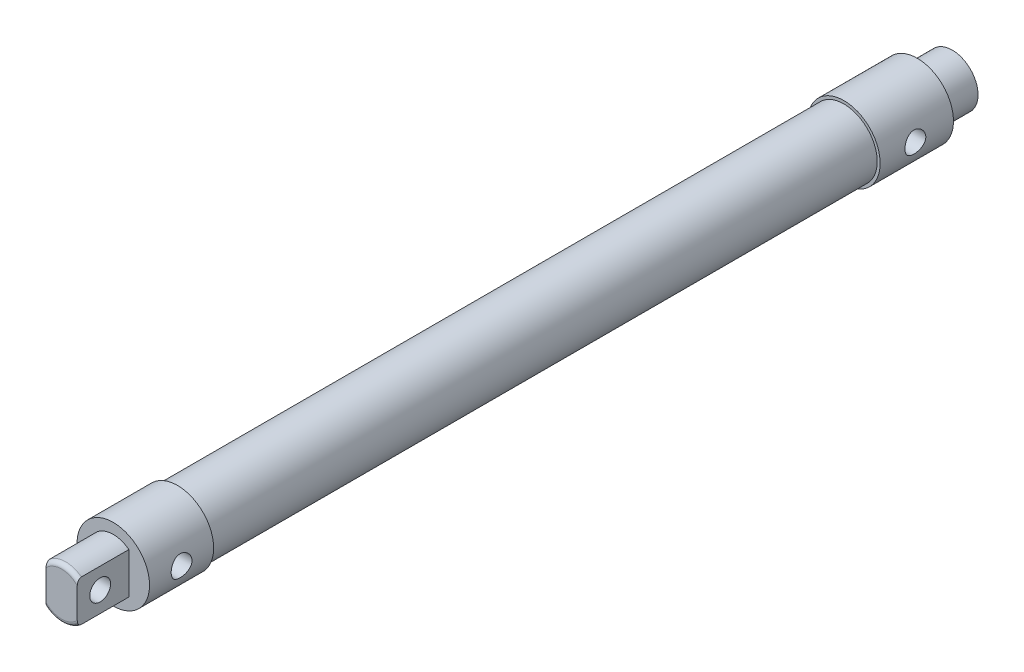
from build123d import *

# Parameters (mm, degrees)
SKETCH1_R               = 10.16
BOSS_EXTRUDE1_DEPTH     = 203.2
SKETCH2_R               = 11.049
BOSS_EXTRUDE2_DEPTH     = 19.558
BOSS_EXTRUDE3_DEPTH     = 15.748
SKETCH4_R               = 3.175
CUT_EXTRUDE1_DEPTH      = 9.525
FILLET1_R               = 1.27
SKETCH5_R               = 11.049
BOSS_EXTRUDE4_DEPTH     = 22.352
SKETCH6_R               = 7.874
BOSS_EXTRUDE5_DEPTH     = 10.668
SKETCH7_R               = 3.175
CUT_EXTRUDE2_DEPTH      = 124.968
CUT_EXTRUDE3_REACH      = 241.017
CUT_EXTRUDE3_END_RADIUS = 11.049
SKETCH8_R               = 3.175


with BuildPart() as part:
    # Sketch1 → Boss-Extrude1 (new body)
    with BuildSketch(Plane.XY):
        Circle(SKETCH1_R)
    extrude(amount=BOSS_EXTRUDE1_DEPTH)

    # Sketch5 → Boss-Extrude4 (add)
    with BuildSketch(Plane(origin=(0, 0, 0), x_dir=(-1, 0, 0), z_dir=(0, 0, -1))):
        with Locations(Location((0, 0, 0), (0, 0, 180))):
            Circle(SKETCH5_R)
    extrude(amount=BOSS_EXTRUDE4_DEPTH)

    # Sketch6 → Boss-Extrude5 (add)
    with BuildSketch(Plane(origin=(0, 0, -22.352), x_dir=(-1, 0, 0), z_dir=(0, 0, -1))):
        Circle(SKETCH6_R)
    extrude(amount=BOSS_EXTRUDE5_DEPTH)

    # Sketch7 → Cut-Extrude2 (cut)
    with BuildSketch(Plane(origin=(0, 0, -33.02), x_dir=(-1, 0, 0), z_dir=(0, 0, -1))):
        Circle(SKETCH7_R)
    extrude(amount=-CUT_EXTRUDE2_DEPTH, mode=Mode.SUBTRACT)


with BuildPart() as body_2:
    # Sketch2 → Boss-Extrude2 (new body)
    with BuildSketch(Plane.XY.offset(203.2)):
        Circle(SKETCH2_R)
    extrude(amount=BOSS_EXTRUDE2_DEPTH)

    # Sketch3 → Boss-Extrude3 (add)
    with BuildSketch(Plane.XY.offset(222.758)):
        with BuildLine():
            Line((4.7625, -6.270444143), (4.7625, 6.270444143))
            ThreePointArc((4.7625, 6.270444143), (0, 7.874), (-4.7625, 6.270444143))
            Line((-4.7625, 6.270444143), (-4.7625, -6.270444143))
            ThreePointArc((-4.7625, -6.270444143), (0, -7.874), (4.7625, -6.270444143))
        make_face()
    extrude(amount=BOSS_EXTRUDE3_DEPTH)

    # Sketch4 → Cut-Extrude1 (cut)
    with BuildSketch(Plane(origin=(4.7625, 0, 0), x_dir=(0, 0, -1), z_dir=(1, 0, 0))):
        with Locations((-231.521, 0)):
            Circle(SKETCH4_R)
    extrude(amount=-CUT_EXTRUDE1_DEPTH, mode=Mode.SUBTRACT)

    # Fillet1
    fillet1_edges = [body_2.edges().sort_by_distance(p)[0] for p in [
        (0, 7.874, 238.506),
        (0, -7.874, 238.506),
    ]]
    fillet(fillet1_edges, radius=FILLET1_R)


with BuildPart() as cut_extrude3_tool:
    # Cut-Extrude3: up to this cylinder (the profile starts inside it)
    cut_extrude3_end = Plane(origin=(0, 0, 101.119601), z_dir=(0, 0, -1)) * Cylinder(CUT_EXTRUDE3_END_RADIUS, 728.850798, mode=Mode.PRIVATE)
    # Sketch8 → Cut-Extrude3 (new, up to the surface)
    with BuildSketch(Plane(origin=(0, 0, 0), x_dir=(0, 0, -1), z_dir=(1, 0, 0)), mode=Mode.PRIVATE) as cut_extrude3_sk1:
        with Locations(Location((-212.979, 0, 0), (0, 0, 270))):
            Circle(SKETCH8_R)
    cut_extrude3_tool1 = extrude(cut_extrude3_sk1.sketch, amount=CUT_EXTRUDE3_REACH, mode=Mode.PRIVATE) & cut_extrude3_end
    add(cut_extrude3_tool1.solids().sort_by_distance((0, 0, 212.979))[0])
    # Sketch8 → Cut-Extrude3 (new, up to the surface)
    with BuildSketch(Plane(origin=(0, 0, 0), x_dir=(0, 0, -1), z_dir=(1, 0, 0)), mode=Mode.PRIVATE) as cut_extrude3_sk2:
        with Locations(Location((10.739797543, 0, 0), (0, 0, 270))):
            Circle(SKETCH8_R)
    cut_extrude3_tool2 = extrude(cut_extrude3_sk2.sketch, amount=CUT_EXTRUDE3_REACH, mode=Mode.PRIVATE) & cut_extrude3_end
    add(cut_extrude3_tool2.solids().sort_by_distance((0, 0, -10.739798))[0])


with BuildPart() as part_1:
    add(part.part)

    # Cut-Extrude3: cut by cut_extrude3_tool
    add(cut_extrude3_tool.part, mode=Mode.SUBTRACT)


with BuildPart() as body_2_1:
    add(body_2.part)

    # Cut-Extrude3: cut by cut_extrude3_tool
    add(cut_extrude3_tool.part, mode=Mode.SUBTRACT)


solid = Compound([part_1.part, body_2_1.part])
